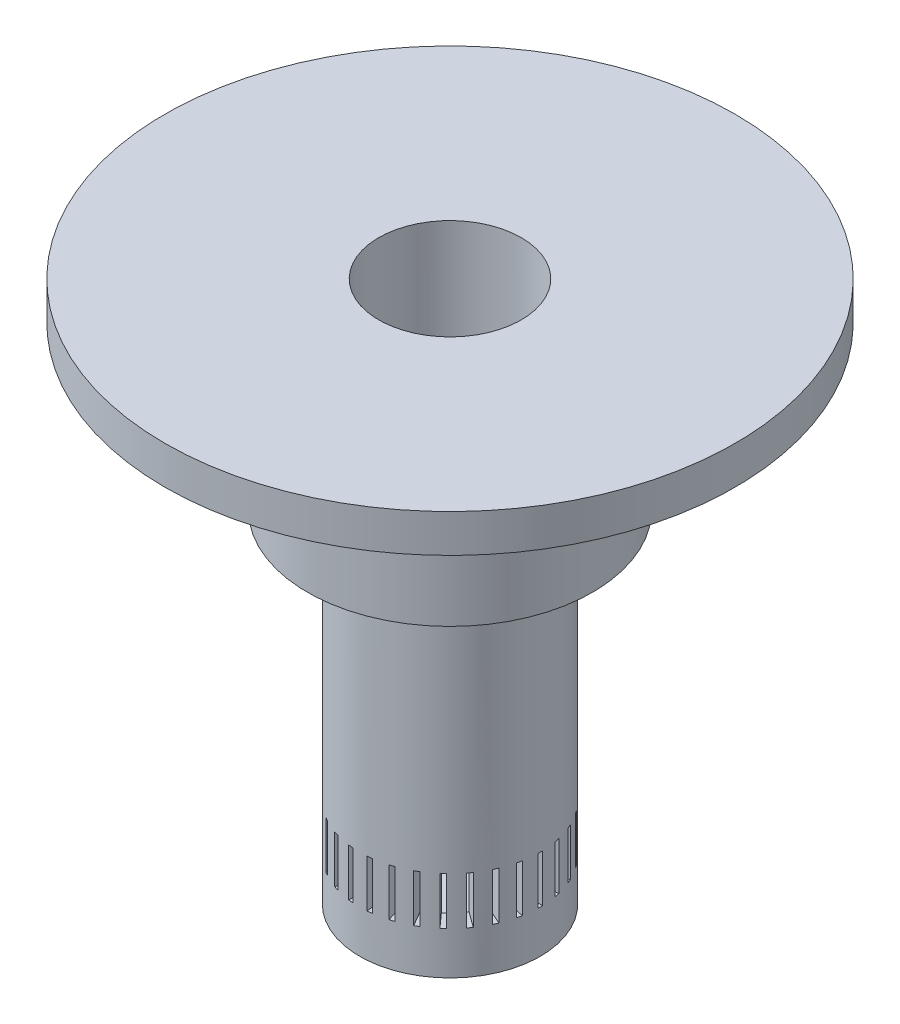
from build123d import *

# Parameters (mm, degrees)
SKETCH4_W          = 0.635
SKETCH4_H          = 6.35
CUT_EXTRUDE2_DEPTH = 6.35
CIRPATTERN1_COUNT  = 30


with BuildPart() as part:
    # Sketch3 → Revolve1 (revolve)
    with BuildSketch(Plane.XY, mode=Mode.PRIVATE) as revolve1_sk:
        Polygon((-38.1, 16.300354852), (-38.1, 11.220354852), (-19.05, 11.220354852), (-19.05, 1.695354852), (-15.24, 1.695354852), (-15.24, -1.479645148), (-19.05, -1.479645148), (-19.05, -10.465654768), (-12.065, -14.179645148), (-12.065, -56.089645148), (0, -56.089645148), (0, -52.279645148), (-9.525, -52.279645148), (-9.525, 16.300354852), align=None)
    revolve(revolve1_sk.sketch.rotate(Axis((0, 0, 0), (0, 1, 0)), 270), axis=Axis((0, 0, 0), (0, 1, 0)))

    # Sketch4 → Cut-Extrude2 (cut)
    with BuildSketch(Plane(origin=(12.065, 0, 0), x_dir=(0, 0, -1), z_dir=(1, 0, 0))):
        with Locations((0, -47.199645148)):
            Rectangle(SKETCH4_W, SKETCH4_H)
    cut_extrude2 = extrude(amount=-CUT_EXTRUDE2_DEPTH, mode=Mode.SUBTRACT)

    # CirPattern1: Cut-Extrude2 ×30 about axis
    cirpattern1_axis = Axis((0, 0, 0), (0, 1, 0))
    for i in range(1, CIRPATTERN1_COUNT):
        add(cut_extrude2.rotate(cirpattern1_axis, i * 360 / CIRPATTERN1_COUNT), mode=Mode.SUBTRACT)


solid = part.part
